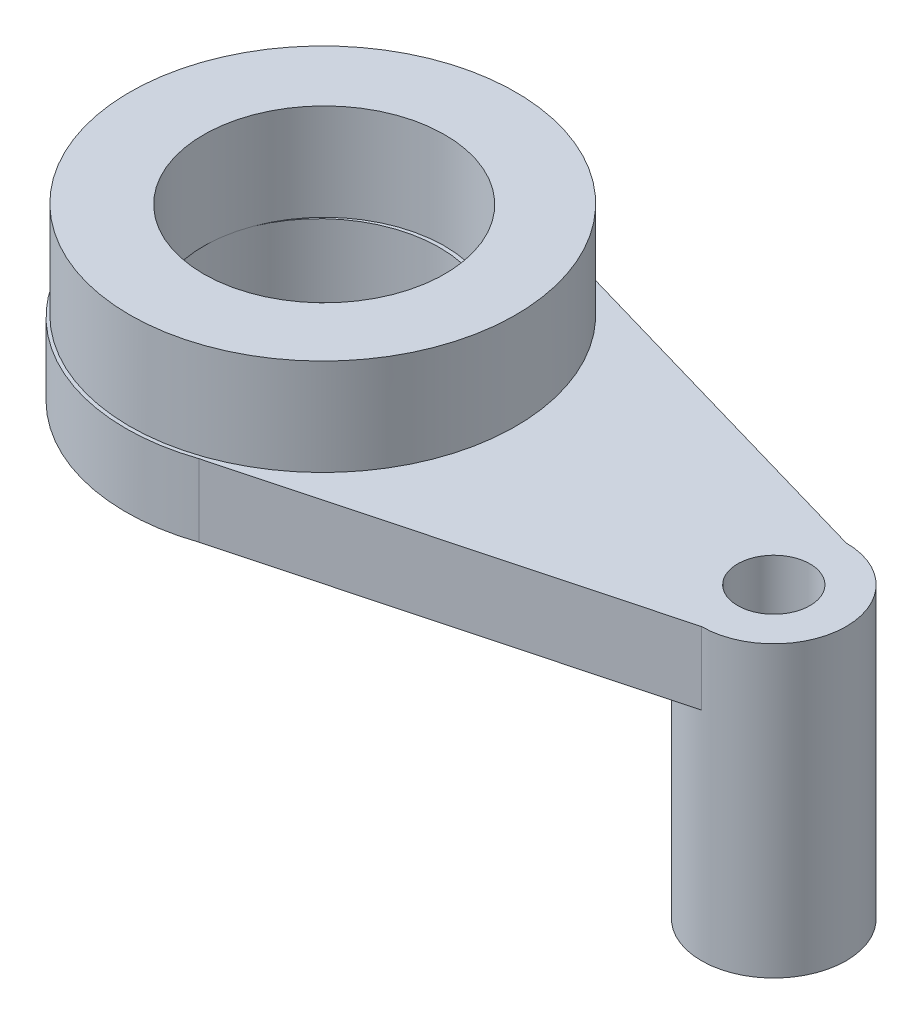
from build123d import *

# Parameters (mm, degrees)
SKETCH2_R            = 3000.000000003
SKETCH2_R_2          = 10000
BOSS_EXTRUDE8_DEPTH  = 6000
SKETCH8_R            = 16000
SKETCH8_R_2          = 10000
BOSS_EXTRUDE9_DEPTH  = 8000
BOSS_EXTRUDE10_START = -24000
SKETCH13_R           = 5999.966921828
SKETCH13_R_2         = 3000.000000003
BOSS_EXTRUDE10_DEPTH = 24000


with BuildPart() as part:
    # Sketch2 → Boss-Extrude8 (new body)
    with BuildSketch(Plane(origin=(0, 0, 0), x_dir=(1, 0, 0), z_dir=(0, 1, 0))):
        with BuildLine():
            Line((5073.292105113, -15446.959810122), (37944.154117519, -6672.927533003))
            ThreePointArc((37944.154117519, -6672.927533003), (43945.568107908, -673.684341785), (37945.601229707, 5327.006136143))
            Line((37945.601229707, 5327.00613614), (4453.528698309, 15017.960239361))
            ThreePointArc((4453.528698309, 15017.960239361), (-16118.590155227, -639.312973304), (5073.292105113, -15446.959810122))
        make_face()
        with Locations(Location((37945.601229707, -672.960785686, 0), (0, 0, 270))):
            Circle(SKETCH2_R, mode=Mode.SUBTRACT)
        with Locations(Location((-121.899995114, -313.884146472, 0), (0, 0, 270))):
            Circle(SKETCH2_R_2, mode=Mode.SUBTRACT)
    extrude(amount=BOSS_EXTRUDE8_DEPTH)

    # Sketch8 → Boss-Extrude9 (add)
    with BuildSketch(Plane(origin=(0, 6000, 0), x_dir=(1, 0, 0), z_dir=(0, 1, 0))):
        with Locations(Location((-121.899995114, 0, 0), (0, 0, 62.711003457))):
            Circle(SKETCH8_R)
        with Locations(Location((0, 0, 0), (0, 0, 159.740517699))):
            Circle(SKETCH8_R_2, mode=Mode.SUBTRACT)
    extrude(amount=BOSS_EXTRUDE9_DEPTH)

    # Sketch13 → Boss-Extrude10 (add)
    with BuildSketch(Plane(origin=(0, 6000, 0), x_dir=(1, 0, 0), z_dir=(0, 1, 0)).offset(BOSS_EXTRUDE10_START)):
        with Locations(Location((37945.601229707, -672.960785686, 0), (0, 0, 90))):
            Circle(SKETCH13_R)
        with Locations(Location((37945.601229707, -672.960785686, 0), (0, 0, 270))):
            Circle(SKETCH13_R_2, mode=Mode.SUBTRACT)
    extrude(amount=BOSS_EXTRUDE10_DEPTH)


solid = part.part
